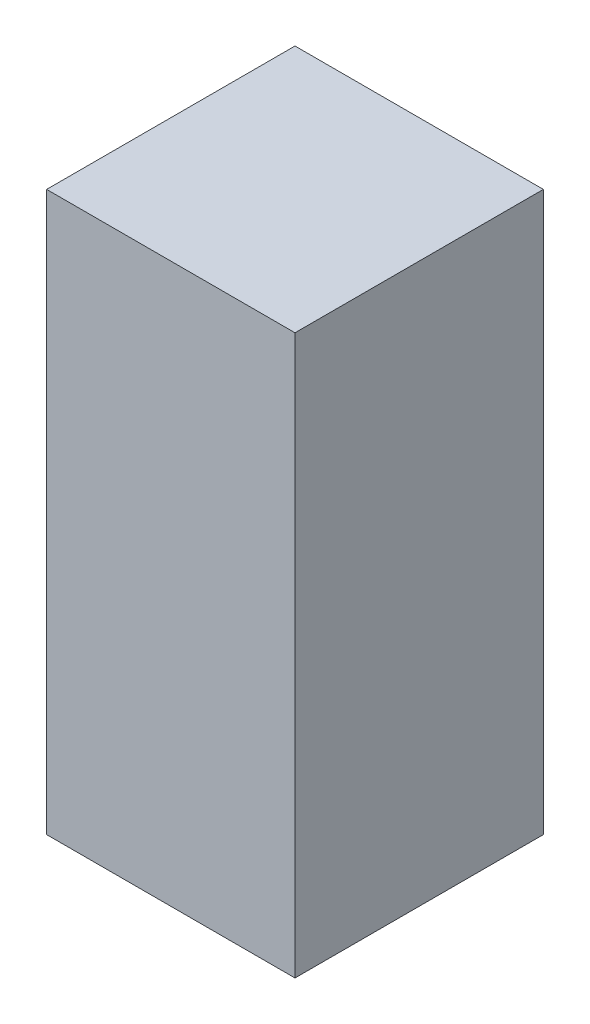
from build123d import *

# Parameters (mm, degrees)
PACK_KOSE_PLOWU_1_1_START = -552.5
SKETCH1_W                 = 20
SKETCH1_H                 = 45
PACK_KOSE_PLOWU_1_1_DEPTH = 20


with BuildPart() as part:
    # Sketch1 → PACK_kose_plowu_1_1 (new body)
    with BuildSketch(Plane.XY.offset(PACK_KOSE_PLOWU_1_1_START)):
        with Locations((187.5, 574.5)):
            Rectangle(SKETCH1_W, SKETCH1_H)
    extrude(amount=-PACK_KOSE_PLOWU_1_1_DEPTH)


solid = part.part
